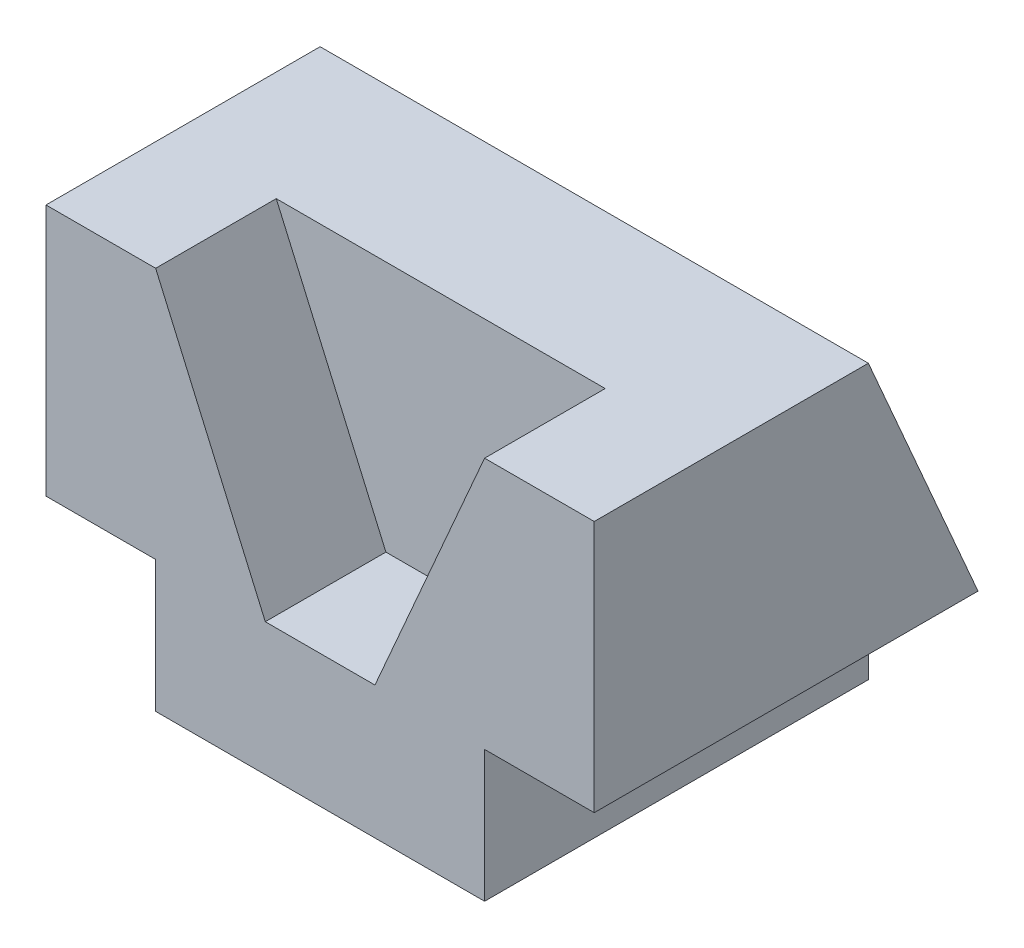
from build123d import *

# Parameters (mm, degrees)
BOSS_EXTRUDE2_DEPTH = 35000
CUT_EXTRUDE1_DEPTH  = 11000
CUT_EXTRUDE2_DEPTH  = 70357.236397351


with BuildPart() as part:
    # Sketch3 → Boss-Extrude2 (new body)
    with BuildSketch(Plane.XY):
        Polygon((-15000, 0), (15000, 0), (15000, 12000), (25000, 12000), (25000, 35000), (-25000, 35000), (-25000, 12000), (-15000, 12000), align=None)
    extrude(amount=BOSS_EXTRUDE2_DEPTH)

    # Sketch4 → Cut-Extrude1 (cut)
    with BuildSketch(Plane.XY.offset(35000)):
        Polygon((-5000, 12082.081474439), (-15000, 35000), (15000, 35000), (5000, 12082.081474439), align=None)
    extrude(amount=-CUT_EXTRUDE1_DEPTH, mode=Mode.SUBTRACT)

    # Sketch6 → Cut-Extrude2 (cut, through all)
    with BuildSketch(Plane.ZY.offset(25000)):
        Polygon((0, 35000), (0, 12000), (10000, 35000), align=None)
    extrude(amount=-CUT_EXTRUDE2_DEPTH, mode=Mode.SUBTRACT)


solid = part.part
